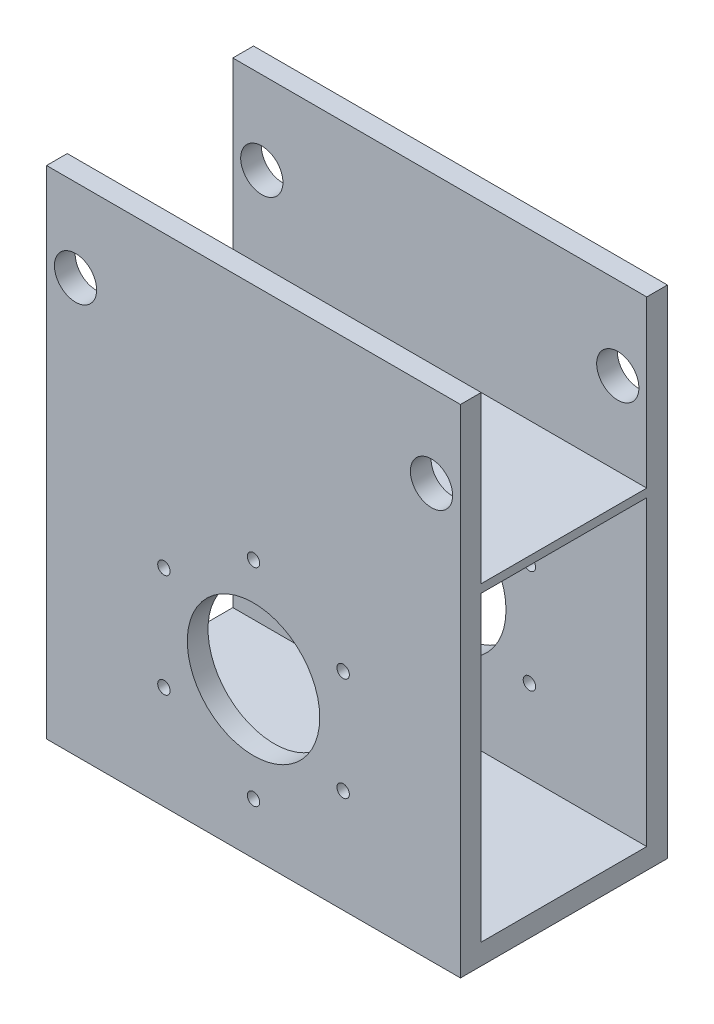
from build123d import *

# Parameters (mm, degrees)
SKETCH1_W                = 100
SKETCH1_H                = 120
BOSS_EXTRUDE1_DEPTH      = 5
SKETCH2_W                = 100
SKETCH2_H                = 2
BOSS_EXTRUDE2_DEPTH      = 45
BOSS_EXTRUDE3_DEPTH      = 40
BOSS_EXTRUDE3_DEPTH_BACK = 60
SKETCH3_W                = 100
SKETCH3_H                = 5
SKETCH6_W                = 100
SKETCH6_H                = 5
BOSS_EXTRUDE4_DEPTH      = 15
SKETCH7_W                = 100
SKETCH7_H                = 5
BOSS_EXTRUDE5_DEPTH      = 45
SKETCH8_R                = 16
SKETCH8_R_2              = 1.5
CUT_EXTRUDE1_DEPTH       = 93.736184955
SKETCH10_R               = 5.1
CUT_EXTRUDE2_DEPTH       = 93.736184955


with BuildPart() as part:
    # Sketch1 → Boss-Extrude1 (new body)
    with BuildSketch(Plane.XY):
        Rectangle(SKETCH1_W, SKETCH1_H)
    extrude(amount=BOSS_EXTRUDE1_DEPTH)

    # Sketch2 → Boss-Extrude2 (add)
    with BuildSketch(Plane.XY.offset(5)):
        with Locations((0, 19)):
            Rectangle(SKETCH2_W, SKETCH2_H)
    extrude(amount=BOSS_EXTRUDE2_DEPTH)

    # Sketch3 → Boss-Extrude3 (add, two sides: drawn at the far end of the back side and taken through both)
    with BuildSketch(Plane(origin=(0, 20, 0), x_dir=(1, 0, 0), z_dir=(0, 1, 0)).offset(-BOSS_EXTRUDE3_DEPTH_BACK)):
        with Locations((0, -47.5)):
            Rectangle(SKETCH3_W, SKETCH3_H)
    extrude(amount=BOSS_EXTRUDE3_DEPTH + BOSS_EXTRUDE3_DEPTH_BACK)

    # Sketch6 → Boss-Extrude4 (add)
    with BuildSketch(Plane.XZ.offset(40)):
        with Locations((0, 47.5)):
            Rectangle(SKETCH6_W, SKETCH6_H)
        with Locations((0, 2.5)):
            Rectangle(SKETCH6_W, SKETCH6_H)
    extrude(amount=BOSS_EXTRUDE4_DEPTH)

    # Sketch7 → Boss-Extrude5 (add)
    with BuildSketch(Plane.XY.offset(5)):
        with Locations((0, -57.5)):
            Rectangle(SKETCH7_W, SKETCH7_H)
    extrude(amount=BOSS_EXTRUDE5_DEPTH)

    # Sketch8 → Cut-Extrude1 (cut, through all)
    with BuildSketch(Plane.XY.offset(50)):
        with Locations((0, -22.5)):
            Circle(SKETCH8_R)
        with Locations((0, 2.5)):
            Circle(SKETCH8_R_2)
        with Locations((21.650635095, -10)):
            Circle(SKETCH8_R_2)
        with Locations((21.650635095, -35)):
            Circle(SKETCH8_R_2)
        with Locations((0, -47.5)):
            Circle(SKETCH8_R_2)
        with Locations((-21.650635095, -35)):
            Circle(SKETCH8_R_2)
        with Locations((-21.650635095, -10)):
            Circle(SKETCH8_R_2)
    extrude(amount=-CUT_EXTRUDE1_DEPTH, mode=Mode.SUBTRACT)

    # Sketch10 → Cut-Extrude2 (cut, through all)
    with BuildSketch(Plane.XY.offset(50)):
        with Locations((-43, 40)):
            Circle(SKETCH10_R)
        with Locations((43, 40)):
            Circle(SKETCH10_R)
    extrude(amount=-CUT_EXTRUDE2_DEPTH, mode=Mode.SUBTRACT)


solid = part.part
